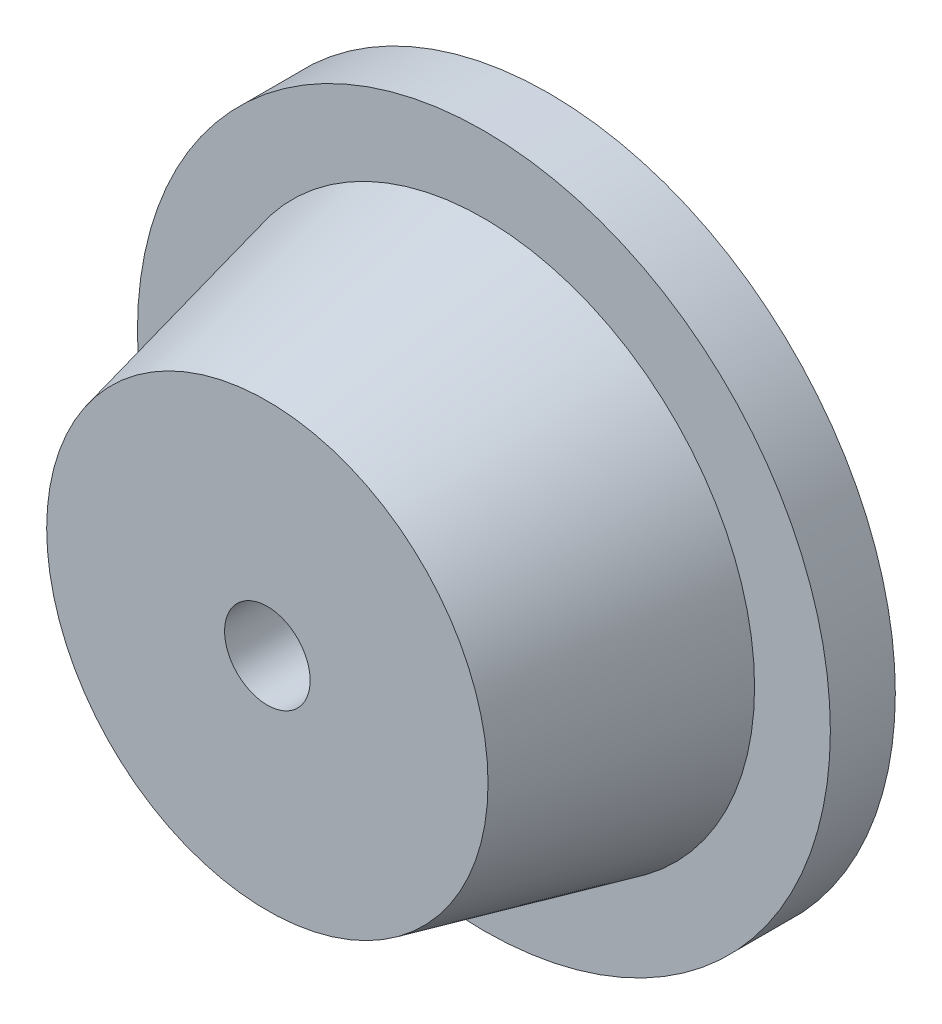
from build123d import *

# Parameters (mm, degrees)
SKETCH1_R           = 16
BOSS_EXTRUDE1_DEPTH = 3
SKETCH2_R           = 12.5
BOSS_EXTRUDE2_DEPTH = 10
BOSS_EXTRUDE2_TAPER = 13
SKETCH3_R           = 1.975
CUT_EXTRUDE1_DEPTH  = 27.095976701


with BuildPart() as part:
    # Sketch1 → Boss-Extrude1 (new body)
    with BuildSketch(Plane.XY):
        Circle(SKETCH1_R)
    extrude(amount=BOSS_EXTRUDE1_DEPTH)

    # Sketch2 → Boss-Extrude2 (add)
    with BuildSketch(Plane.XY.offset(3)):
        Circle(SKETCH2_R)
    extrude(amount=BOSS_EXTRUDE2_DEPTH, taper=BOSS_EXTRUDE2_TAPER)

    # Sketch3 → Cut-Extrude1 (cut, through all)
    with BuildSketch(Plane.XY.offset(13)):
        Circle(SKETCH3_R)
    extrude(amount=-CUT_EXTRUDE1_DEPTH, mode=Mode.SUBTRACT)


solid = part.part
